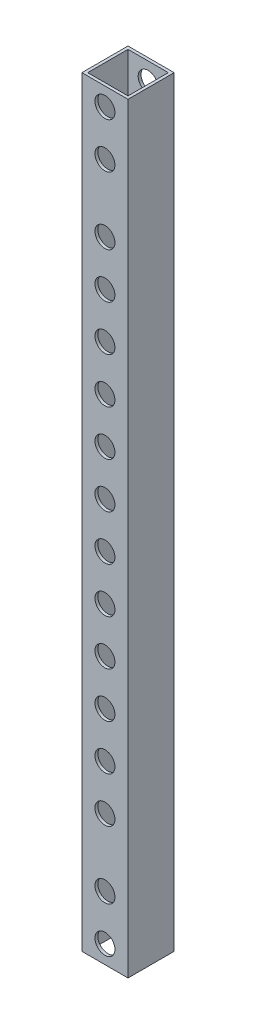
from build123d import *

# Parameters (mm, degrees)
SKETCH1_W                       = 25.4
SKETCH1_H                       = 25.4
SKETCH1_W_2                     = 22.225
SKETCH1_H_2                     = 22.225
EXTRUDE_THIN1_DEPTH             = 419.1
M10_CLEARANCE_HOLE1_D           = 11
M10_CLEARANCE_HOLE1_CSINK_D     = 11.05
M10_CLEARANCE_HOLE1_CSINK_ANGLE = 90
M10_CLEARANCE_HOLE2_D           = 11
M10_CLEARANCE_HOLE2_CSINK_D     = 11.05
M10_CLEARANCE_HOLE2_CSINK_ANGLE = 90
LPATTERN2_COUNT                 = 6
LPATTERN2_PITCH                 = 25
LPATTERN2_COL_COUNT             = 6
LPATTERN2_COL_PITCH             = 25


with BuildPart() as part:
    # Sketch1 → Extrude-Thin1 (new body)
    with BuildSketch(Plane(origin=(0, 0, 0), x_dir=(1, 0, 0), z_dir=(0, 1, 0))):
        Rectangle(SKETCH1_W, SKETCH1_H)
        Rectangle(SKETCH1_W_2, SKETCH1_H_2, mode=Mode.SUBTRACT)
    extrude(amount=EXTRUDE_THIN1_DEPTH)

    # M10 Clearance Hole1 (through all)
    with Locations(Plane(origin=(0, 0, -12.7), x_dir=(-1, 0, 0), z_dir=(0, 0, -1))):
        with Locations((0, 409.1), (0, 384.1), (0, 35), (0, 10)):
            CounterSinkHole(M10_CLEARANCE_HOLE1_D / 2, M10_CLEARANCE_HOLE1_CSINK_D / 2, counter_sink_angle=M10_CLEARANCE_HOLE1_CSINK_ANGLE)

    # M10 Clearance Hole2 (through all)
    with Locations(Plane(origin=(0, 0, -12.7), x_dir=(-1, 0, 0), z_dir=(0, 0, -1))):
        with Locations((0, 197.05), (0, 222.05)):
            m10_clearance_hole2 = CounterSinkHole(M10_CLEARANCE_HOLE2_D / 2, M10_CLEARANCE_HOLE2_CSINK_D / 2, counter_sink_angle=M10_CLEARANCE_HOLE2_CSINK_ANGLE)

    # LPattern2: M10 Clearance Hole2 ×6
    with Locations(*[(0, i * LPATTERN2_PITCH, 0) for i in range(1, LPATTERN2_COUNT)]):
        add(m10_clearance_hole2, mode=Mode.SUBTRACT)

    # LPattern2 col: M10 Clearance Hole2 ×6
    with Locations(*[(0, -i * LPATTERN2_COL_PITCH, 0) for i in range(1, LPATTERN2_COL_COUNT)]):
        add(m10_clearance_hole2, mode=Mode.SUBTRACT)


solid = part.part
